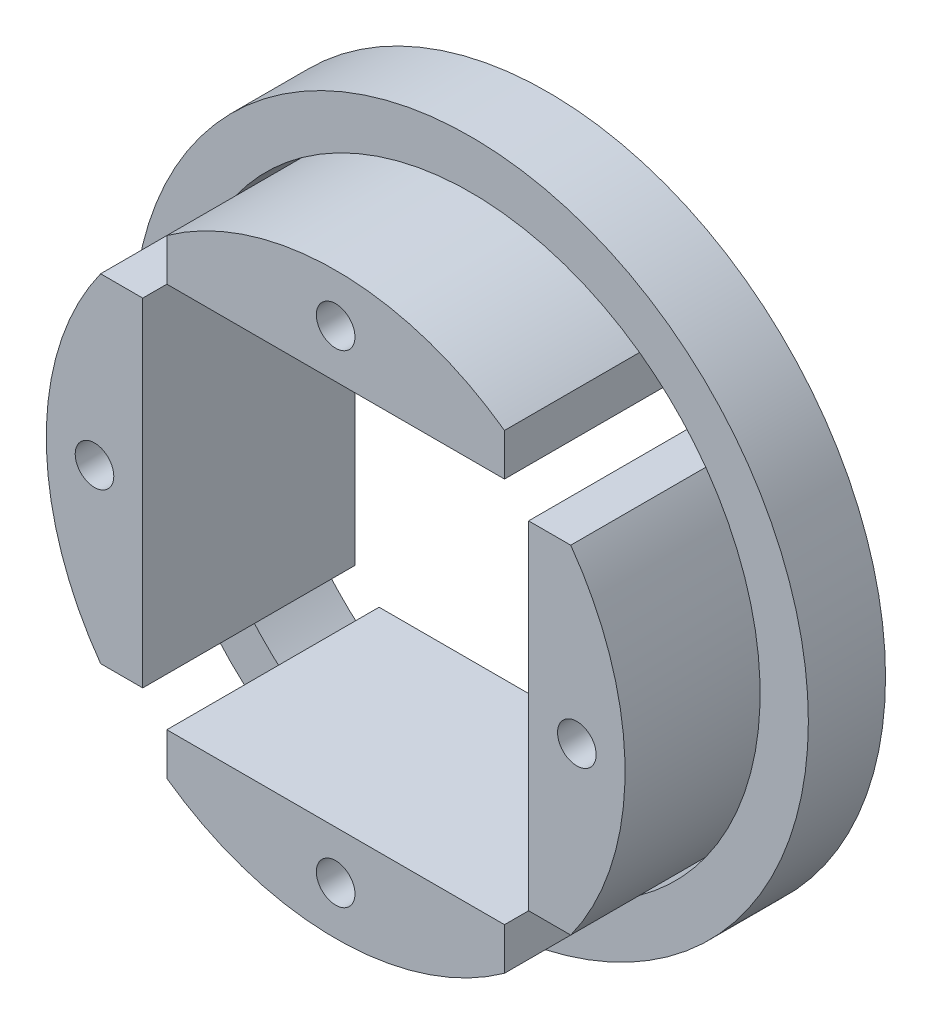
from build123d import *

# Parameters (mm, degrees)
SKETCH_1_R          = 1
EXTRUDE_1_DEPTH     = 7
EXTRUDE_1_2_DEPTH   = 7
EXTRUDE_1_3_DEPTH   = 7
EXTRUDE_1_4_DEPTH   = 7
EXTRUDE_START       = -4
SKETCH_1_3_R        = 17.5
SKETCH_1_3_R_2      = 1
EXTRUDE_2_DEPTH     = 4
CUT_EXTRUDE_1_DEPTH = 3


with BuildPart() as part:
    # 草图1 → 凸台-拉伸1 (new body)
    with BuildSketch(Plane.XY):
        with BuildLine():
            Line((-8.75, 12.183492931), (-8.75, 10))
            Line((-8.75, 10), (8.75, 10))
            Line((8.75, 10), (8.75, 12.183492931))
            ThreePointArc((8.75, 12.183492931), (0, 15), (-8.75, 12.183492931))
        make_face()
        with Locations((0, 12.5)):
            Circle(SKETCH_1_R, mode=Mode.SUBTRACT)
    extrude(amount=EXTRUDE_1_DEPTH)



with BuildPart() as body_2:
    # 草图1 → Extrude 1 2 (new body)
    with BuildSketch(Plane.XY):
        with BuildLine():
            Line((-10, 8.75), (-12.183492931, 8.75))
            ThreePointArc((-12.183492931, 8.75), (-15, 0), (-12.183492931, -8.75))
            Line((-12.183492931, -8.75), (-10, -8.75))
            Line((-10, -8.75), (-10, 8.75))
        make_face()
        with Locations((-12.5, 0)):
            Circle(SKETCH_1_R, mode=Mode.SUBTRACT)
    extrude(amount=EXTRUDE_1_2_DEPTH)


with BuildPart() as body_3:
    # 草图1 → Extrude 1 3 (new body)
    with BuildSketch(Plane.XY):
        with BuildLine():
            ThreePointArc((12.183492931, -8.75), (15, 0), (12.183492931, 8.75))
            Line((12.183492931, 8.75), (10, 8.75))
            Line((10, 8.75), (10, -8.75))
            Line((10, -8.75), (12.183492931, -8.75))
        make_face()
        with Locations((12.5, 0)):
            Circle(SKETCH_1_R, mode=Mode.SUBTRACT)
    extrude(amount=EXTRUDE_1_3_DEPTH)


with BuildPart() as body_4:
    # 草图1 → Extrude 1 4 (new body)
    with BuildSketch(Plane.XY):
        with BuildLine():
            Line((-8.75, -10), (-8.75, -12.183492931))
            ThreePointArc((-8.75, -12.183492931), (0, -15), (8.75, -12.183492931))
            Line((8.75, -12.183492931), (8.75, -10))
            Line((8.75, -10), (-8.75, -10))
        make_face()
        with Locations((0, -12.5)):
            Circle(SKETCH_1_R, mode=Mode.SUBTRACT)
    extrude(amount=EXTRUDE_1_4_DEPTH)


with BuildPart() as part_1:
    add(part.part)

    add(body_2.part)  # 凸台-拉伸2 merges body 2

    add(body_3.part)  # 凸台-拉伸2 merges body 3

    add(body_4.part)  # 凸台-拉伸2 merges body 4
    # 草图1<3> → 凸台-拉伸2 (add)
    with BuildSketch(Plane.XY.offset(EXTRUDE_START)):
        Circle(SKETCH_1_3_R)
        with BuildLine():
            Line((-8.75, 12.183492931), (-8.75, 10))
            Line((-8.75, 10), (8.75, 10))
            Line((8.75, 10), (8.75, 12.183492931))
            ThreePointArc((8.75, 12.183492931), (10.606601718, 10.606601718), (12.183492931, 8.75))
            Line((12.183492931, 8.75), (10, 8.75))
            Line((10, 8.75), (10, -8.75))
            Line((10, -8.75), (12.183492931, -8.75))
            ThreePointArc((12.183492931, -8.75), (10.606601718, -10.606601718), (8.75, -12.183492931))
            Line((8.75, -12.183492931), (8.75, -10))
            Line((8.75, -10), (-8.75, -10))
            Line((-8.75, -10), (-8.75, -12.183492931))
            ThreePointArc((-8.75, -12.183492931), (-10.606601718, -10.606601718), (-12.183492931, -8.75))
            Line((-12.183492931, -8.75), (-10, -8.75))
            Line((-10, -8.75), (-10, 8.75))
            Line((-10, 8.75), (-12.183492931, 8.75))
            ThreePointArc((-12.183492931, 8.75), (-10.606601718, 10.606601718), (-8.75, 12.183492931))
        make_face(mode=Mode.SUBTRACT)
        with Locations((0, 12.5)):
            Circle(SKETCH_1_3_R_2, mode=Mode.SUBTRACT)
        with Locations((-12.5, 0)):
            Circle(SKETCH_1_3_R_2, mode=Mode.SUBTRACT)
        with Locations((0, -12.5)):
            Circle(SKETCH_1_3_R_2, mode=Mode.SUBTRACT)
        with Locations((12.5, 0)):
            Circle(SKETCH_1_3_R_2, mode=Mode.SUBTRACT)
    extrude(amount=EXTRUDE_2_DEPTH)

    # 草图2 → 切除-拉伸1 (cut)
    with BuildSketch(Plane(origin=(0, 0, -4), x_dir=(-1, 0, 0), z_dir=(0, 0, -1))):
        Polygon((10.5, -1.154700538), (12.5, -2.309401077), (14.5, -1.154700538), (14.5, 1.154700538), (12.5, 2.309401077), (10.5, 1.154700538), align=None)
        Polygon((1.154700538, 10.5), (2.309401077, 12.5), (1.154700538, 14.5), (-1.154700538, 14.5), (-2.309401077, 12.5), (-1.154700538, 10.5), align=None)
        Polygon((-1.154700538, -10.5), (-2.309401077, -12.5), (-1.154700538, -14.5), (1.154700538, -14.5), (2.309401077, -12.5), (1.154700538, -10.5), align=None)
        Polygon((-10.5, 1.154700538), (-12.5, 2.309401077), (-14.5, 1.154700538), (-14.5, -1.154700538), (-12.5, -2.309401077), (-10.5, -1.154700538), align=None)
    extrude(amount=-CUT_EXTRUDE_1_DEPTH, mode=Mode.SUBTRACT)


solid = part_1.part
